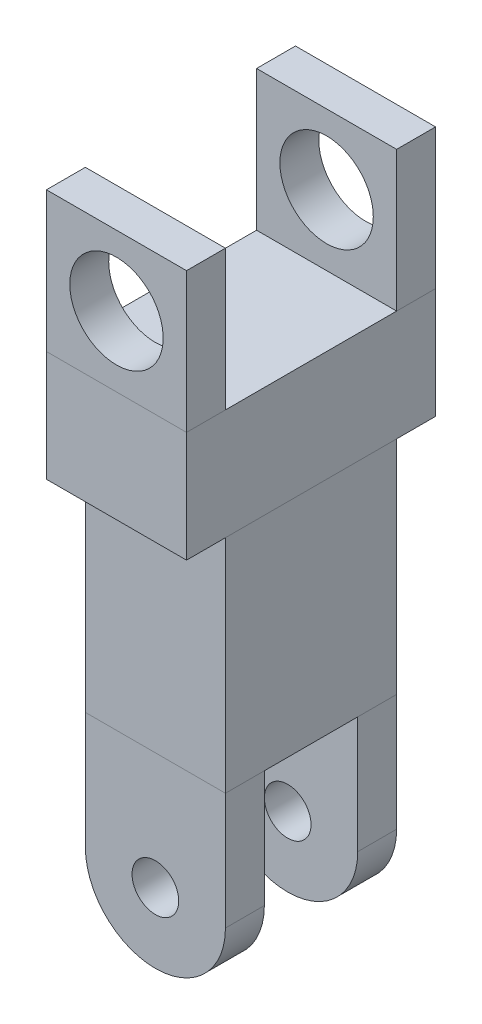
from build123d import *

# Parameters (mm, degrees)
SKETCH1_R             = 4.5
SKETCH1_R_2           = 1.5
BOSS_EXTRUDE1_DEPTH   = 2.5
SKETCH4_R             = 4.5
SKETCH4_R_2           = 1.5
BOSS_EXTRUDE2_DEPTH   = 2.5
SKETCH5_W             = 9
SKETCH5_H             = 11
BOSS_EXTRUDE3_DEPTH   = 14.22
SKETCH6_W             = 9
SKETCH6_H             = 2.5
SKETCH6_H_2           = 11
BOSS_EXTRUDE4_DEPTH   = 7.11
SKETCH7_W             = 9
SKETCH7_H             = 2.5
BOSS_EXTRUDE5_DEPTH   = 9
BOSS_EXTRUDE5_2_DEPTH = 9
SKETCH8_R             = 3
CUT_EXTRUDE1_DEPTH    = 16


with BuildPart() as part:
    # Sketch1 → Boss-Extrude1 (new body)
    # profile 1 of 2: a face of its own
    with BuildSketch(Plane.XY):
        Circle(SKETCH1_R)
        Circle(SKETCH1_R_2, mode=Mode.SUBTRACT)
    # profile 2 of 2: a face of its own
    with BuildSketch(Plane.XY):
        with BuildLine():
            Line((-4.5, 7.5), (-4.5, 0))
            ThreePointArc((-4.5, 0), (0, 4.5), (4.5, 0))
            Line((4.5, 0), (4.5, 7.5))
            Line((4.5, 7.5), (-4.5, 7.5))
        make_face()
    extrude(amount=-BOSS_EXTRUDE1_DEPTH)


with BuildPart() as body_2:
    # Sketch4 → Boss-Extrude2 (new body)
    # profile 1 of 2: a face of its own
    with BuildSketch(Plane(origin=(0, 0, -11), x_dir=(-1, 0, 0), z_dir=(0, 0, -1))):
        Circle(SKETCH4_R)
        Circle(SKETCH4_R_2, mode=Mode.SUBTRACT)
    # profile 2 of 2: a face of its own
    with BuildSketch(Plane(origin=(0, 0, -11), x_dir=(-1, 0, 0), z_dir=(0, 0, -1))):
        with BuildLine():
            Line((-4.5, 7.5), (-4.5, 0))
            ThreePointArc((-4.5, 0), (0, 4.5), (4.5, 0))
            Line((4.5, 0), (4.5, 7.5))
            Line((4.5, 7.5), (-4.5, 7.5))
        make_face()
    extrude(amount=-BOSS_EXTRUDE2_DEPTH)


with BuildPart() as body_3:
    # Sketch5 → Boss-Extrude3 (new body)
    with BuildSketch(Plane(origin=(0, 7.5, 0), x_dir=(1, 0, 0), z_dir=(0, 1, 0))):
        with Locations((0, 5.5)):
            Rectangle(SKETCH5_W, SKETCH5_H)
    extrude(amount=BOSS_EXTRUDE3_DEPTH)


with BuildPart() as body_4:
    # Sketch6 → Boss-Extrude4 (new body)
    with BuildSketch(Plane(origin=(0, 21.72, 0), x_dir=(1, 0, 0), z_dir=(0, 1, 0))):
        with Locations((0, 12.25)):
            Rectangle(SKETCH6_W, SKETCH6_H)
        with Locations((0, 5.5)):
            Rectangle(SKETCH6_W, SKETCH6_H_2)
        with Locations((0, -1.25)):
            Rectangle(SKETCH6_W, SKETCH6_H)
    extrude(amount=BOSS_EXTRUDE4_DEPTH)


with BuildPart() as body_5:
    # Sketch7 → Boss-Extrude5 (new body)
    with BuildSketch(Plane(origin=(0, 28.83, 0), x_dir=(1, 0, 0), z_dir=(0, 1, 0))):
        with Locations((0, 12.25)):
            Rectangle(SKETCH7_W, SKETCH7_H)
    extrude(amount=BOSS_EXTRUDE5_DEPTH)


with BuildPart() as body_6:
    # Sketch7 → Boss-Extrude5 2 (new body)
    with BuildSketch(Plane(origin=(0, 28.83, 0), x_dir=(1, 0, 0), z_dir=(0, 1, 0))):
        with Locations((0, -1.25)):
            Rectangle(SKETCH7_W, SKETCH7_H)
    extrude(amount=BOSS_EXTRUDE5_2_DEPTH)


with BuildPart() as cut_extrude1_tool:
    # Sketch8 → Cut-Extrude1 (new body)
    with BuildSketch(Plane(origin=(0, 0, -13.5), x_dir=(-1, 0, 0), z_dir=(0, 0, -1))):
        with Locations((0, 33.33)):
            Circle(SKETCH8_R)
    extrude(amount=-CUT_EXTRUDE1_DEPTH)


with BuildPart() as body_5_1:
    add(body_5.part)

    # Cut-Extrude1: cut by cut_extrude1_tool
    add(cut_extrude1_tool.part, mode=Mode.SUBTRACT)


with BuildPart() as body_6_1:
    add(body_6.part)

    # Cut-Extrude1: cut by cut_extrude1_tool
    add(cut_extrude1_tool.part, mode=Mode.SUBTRACT)


solid = Compound([part.part, body_2.part, body_3.part, body_4.part, body_5_1.part, body_6_1.part])
